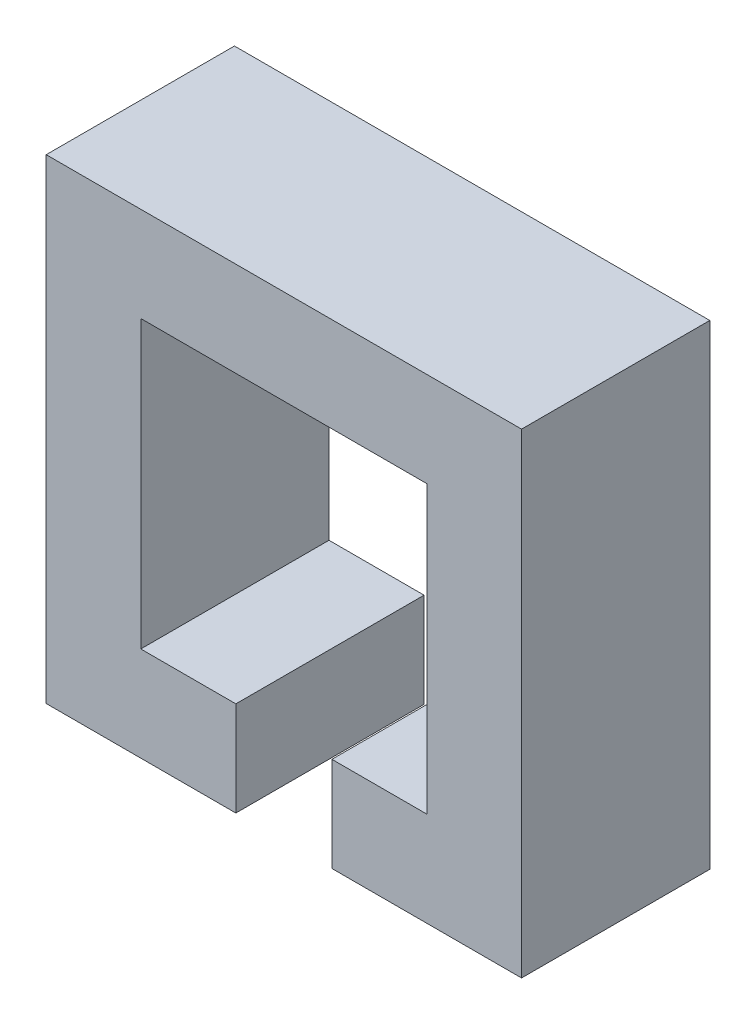
from build123d import *

# Parameters (mm, degrees)
BOSS_EXTRUDE1_DEPTH = 9.899999946


with BuildPart() as part:
    # Sketch1 → Boss-Extrude1 (new body)
    with BuildSketch(Plane.XY.offset(9.899999946)):
        Polygon((-7.525999918, -25.025998801), (-7.525999918, -9.973999896), (7.526500038, -9.973999896), (7.526500038, -25.025998801), (2.526499992, -25.025998801), (2.526499992, -29.999998882), (12.5, -29.999998882), (12.5, -4.999999814), (-12.5, -4.999999814), (-12.5, -29.999998882), (-2.525999872, -29.999998882), (-2.525999872, -25.025998801), align=None)
    extrude(amount=-BOSS_EXTRUDE1_DEPTH)


solid = part.part
